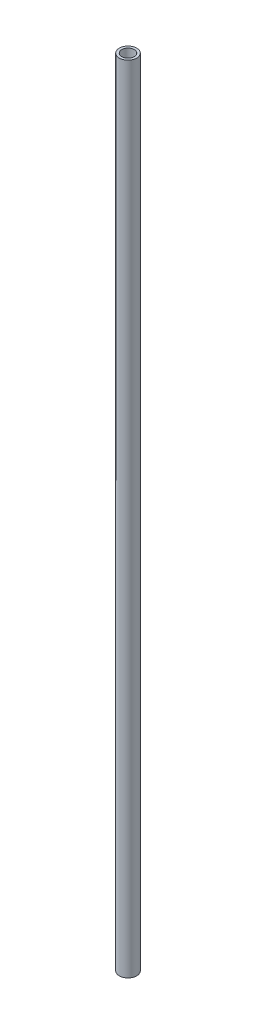
from build123d import *

# Parameters (mm, degrees)
SKETCH1_R           = 13.335
SKETCH1_R_2         = 9.525
BOSS_EXTRUDE1_DEPTH = 1219.2


with BuildPart() as part:
    # Sketch1 → Boss-Extrude1 (new body)
    with BuildSketch(Plane(origin=(0, 0, 0), x_dir=(1, 0, 0), z_dir=(0, 1, 0))):
        with Locations(Location((0, 0, 0), (0, 0, 90))):
            Circle(SKETCH1_R)
        with Locations(Location((0, 0, 0), (0, 0, 90))):
            Circle(SKETCH1_R_2, mode=Mode.SUBTRACT)
    extrude(amount=BOSS_EXTRUDE1_DEPTH)


solid = part.part
